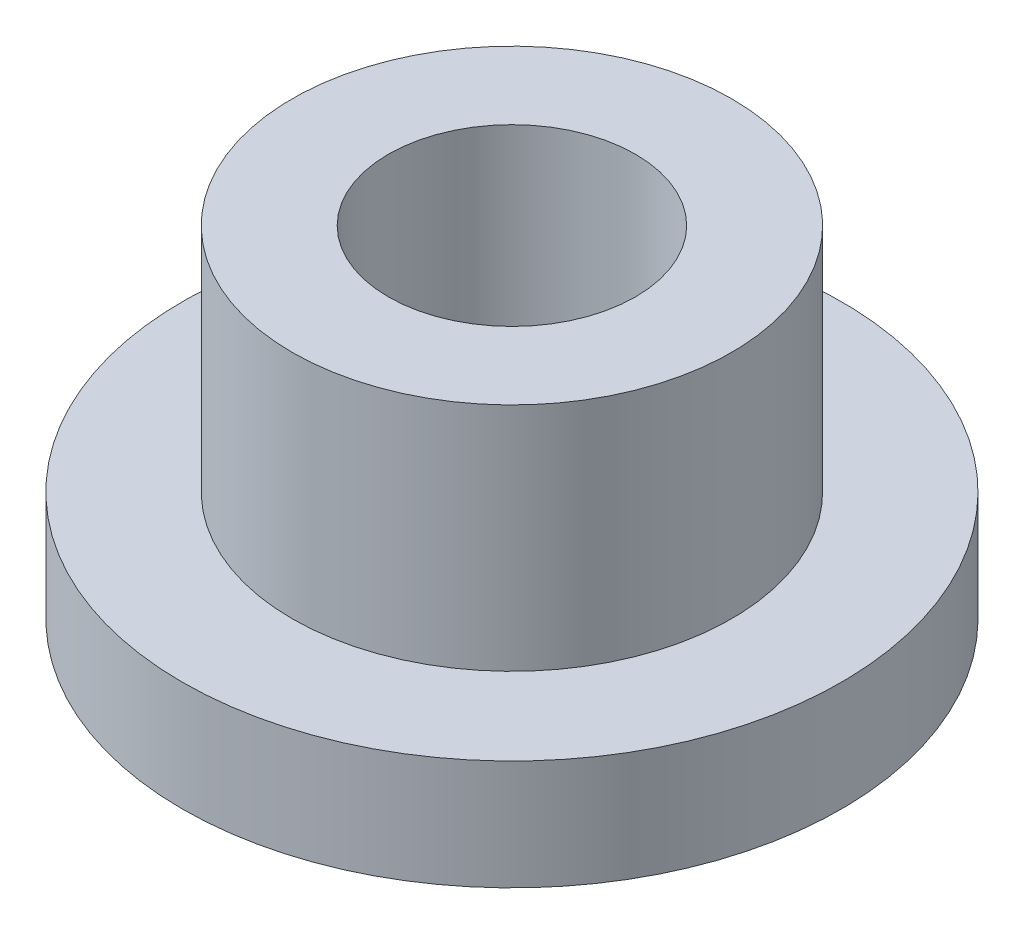
from build123d import *

# Parameters (mm, degrees)
SKETCH1_R               = 2
BOSS_EXTRUDE1_DEPTH     = 2.1
SKETCH1_3_R             = 3
BOSS_EXTRUDE2_DEPTH     = 1
CUT_EXTRUDE1_DEPTH      = 5.733920151
CUT_EXTRUDE1_DEPTH_BACK = 5.733920151
SKETCH1_4_R             = 1.125


with BuildPart() as part:
    # Sketch1 → Boss-Extrude1 (new body)
    with BuildSketch(Plane(origin=(0, 0, 0), x_dir=(1, 0, 0), z_dir=(0, 1, 0))):
        Circle(SKETCH1_R)
    extrude(amount=BOSS_EXTRUDE1_DEPTH)

    # Sketch1<3> → Boss-Extrude2 (add)
    with BuildSketch(Plane(origin=(0, 0, 0), x_dir=(1, 0, 0), z_dir=(0, 1, 0))):
        Circle(SKETCH1_3_R)
        Polygon((0.894892917, -1.55), (1.789785834, 0), (0.894892917, 1.55), (-0.894892917, 1.55), (-1.789785834, 0), (-0.894892917, -1.55), align=None, mode=Mode.SUBTRACT)
    extrude(amount=-BOSS_EXTRUDE2_DEPTH)

    # Sketch1<4> → Cut-Extrude1 (cut, two sides: drawn at the far end of the back side and taken through both)
    with BuildSketch(Plane(origin=(0, 0, 0), x_dir=(1, 0, 0), z_dir=(0, 1, 0)).offset(-CUT_EXTRUDE1_DEPTH_BACK)):
        Circle(SKETCH1_4_R)
    extrude(amount=CUT_EXTRUDE1_DEPTH + CUT_EXTRUDE1_DEPTH_BACK, mode=Mode.SUBTRACT)


solid = part.part
